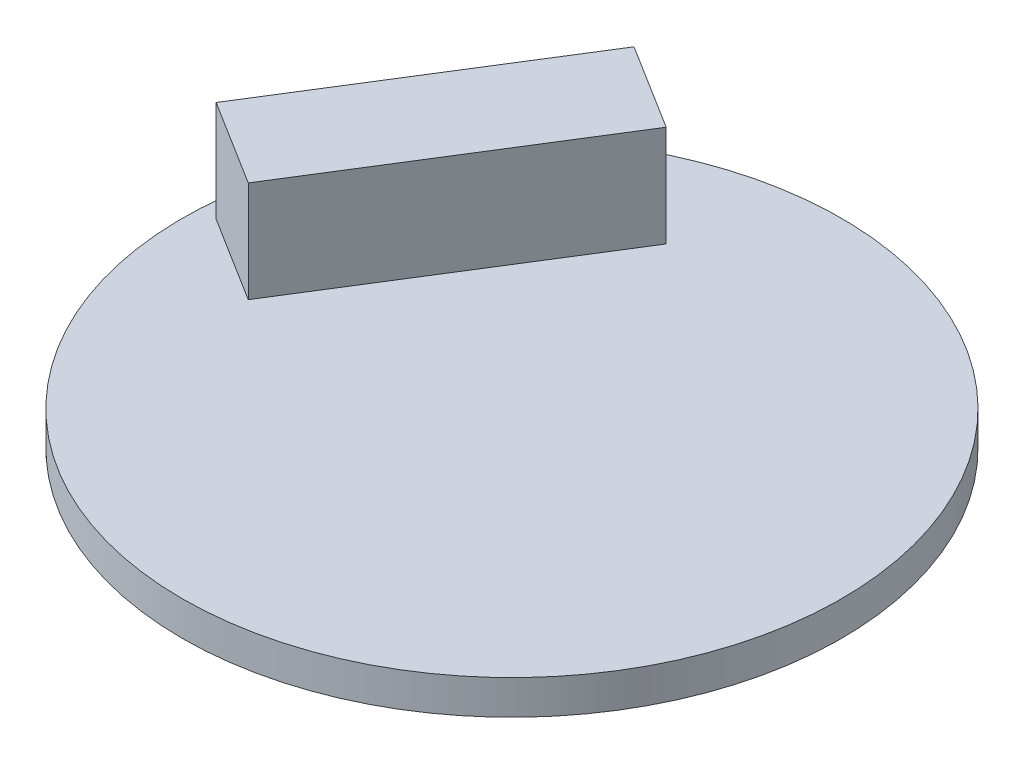
from build123d import *

# Parameters (mm, degrees)
SKETCH1_R           = 16.3
BOSS_EXTRUDE1_DEPTH = 1.7
BOSS_EXTRUDE2_DEPTH = 5
SKETCH3_W           = 12.912487974
SKETCH3_H           = 3.215299838
CUT_EXTRUDE1_DEPTH  = 4


with BuildPart() as part:
    # Sketch1 → Boss-Extrude1 (new body)
    with BuildSketch(Plane(origin=(0, 0, 0), x_dir=(1, 0, 0), z_dir=(0, 1, 0))):
        with Locations(Location((0, 0, 0), (0, 0, 270))):
            Circle(SKETCH1_R)
    extrude(amount=BOSS_EXTRUDE1_DEPTH)

    # Sketch2 → Boss-Extrude2 (add)
    with BuildSketch(Plane(origin=(0, 1.7, 0), x_dir=(1, 0, 0), z_dir=(0, 1, 0))):
        Polygon((-7.474254816, 13.514270788), (-15.42304378, 0.793549346), (-11.182803299, -1.856046975), (-3.234014336, 10.864674467), align=None)
    extrude(amount=BOSS_EXTRUDE2_DEPTH)

    # Sketch3 → Cut-Extrude1 (cut)
    with BuildSketch(Plane(origin=(-11.448649298, 0, -7.153910067), x_dir=(-0.5299192642332052, 0, 0.8480480961564258), z_dir=(-0.8480480961564258, 0, -0.5299192642332052))):
        with Locations((0, 4.2)):
            Rectangle(SKETCH3_W, SKETCH3_H)
    extrude(amount=-CUT_EXTRUDE1_DEPTH, mode=Mode.SUBTRACT)


solid = part.part
